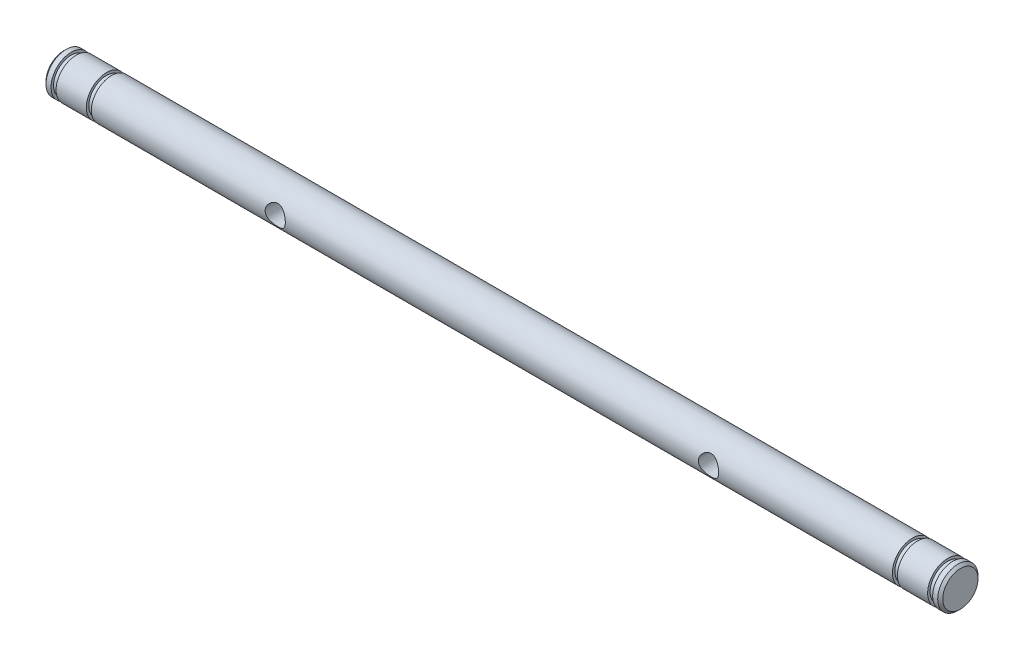
from build123d import *

# Parameters (mm, degrees)
CHAMFER_1_SIZE      = 0.5
SKETCH_2_R          = 2
CUT_EXTRUDE_1_DEPTH = 9


with BuildPart() as part:
    # 草图1 → 旋转1 (revolve)
    with BuildSketch(Plane.XY, mode=Mode.PRIVATE) as revolve_1_sk:
        Polygon((-89, 0), (89, 0), (89, 4), (87.5, 4), (87.5, 3.5), (86.5, 3.5), (86.5, 4), (80.5, 4), (80.5, 3.5), (79.5, 3.5), (79.5, 4), (-79.5, 4), (-79.5, 3.5), (-80.5, 3.5), (-80.5, 4), (-86.5, 4), (-86.5, 3.5), (-87.5, 3.5), (-87.5, 4), (-89, 4), align=None)
    revolve(revolve_1_sk.sketch.rotate(Axis((25.510334062, 0, 0), (1, 0, 0)), 90), axis=Axis((25.510334062, 0, 0), (1, 0, 0)))

    # 倒角1
    chamfer_1_edges = [part.edges().sort_by_distance(p)[0] for p in [
        (89, 0, -4),
        (-89, 0, -4),
    ]]
    chamfer(chamfer_1_edges, length=CHAMFER_1_SIZE)

    # 草图2 → 切除-拉伸1 (cut)
    with BuildSketch(Plane.XY.offset(5)):
        with Locations((43, 0)):
            Circle(SKETCH_2_R)
        with Locations((-43, 0)):
            Circle(SKETCH_2_R)
    extrude(amount=-CUT_EXTRUDE_1_DEPTH, mode=Mode.SUBTRACT)


solid = part.part
